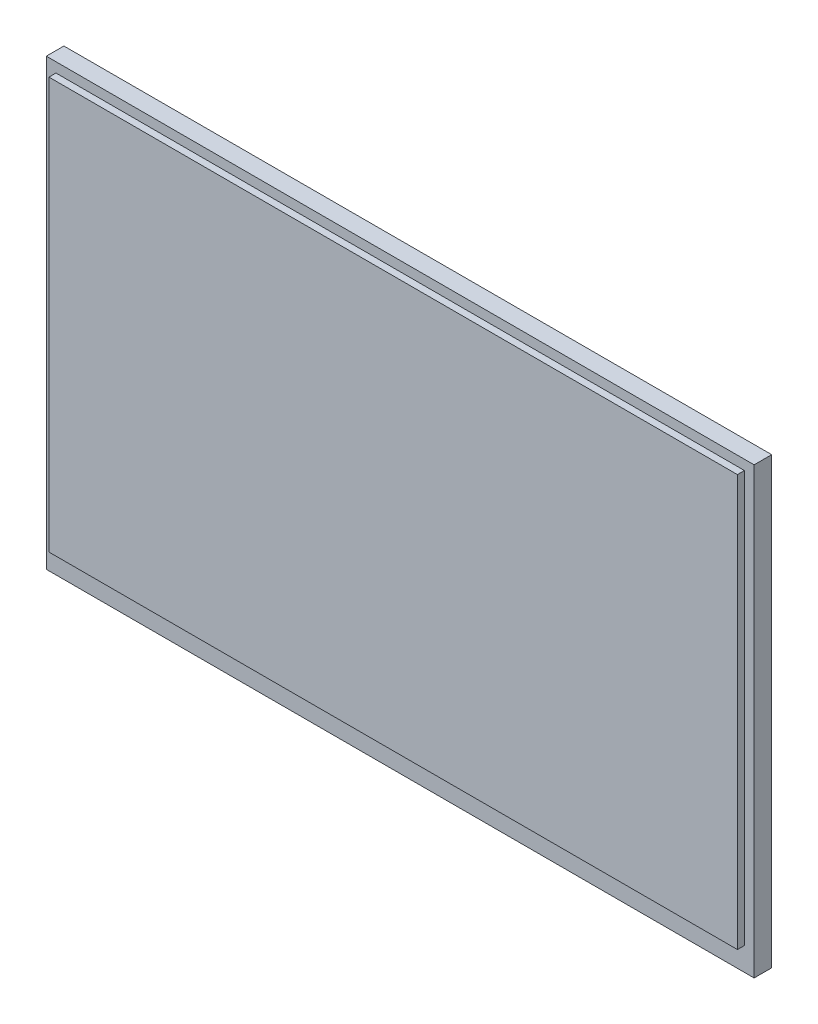
from build123d import *

# Parameters (mm, degrees)
SKETCH1_W           = 120.8
SKETCH1_H           = 75.85
BOSS_EXTRUDE1_DEPTH = 3
SKETCH2_W           = 117.5
SKETCH2_H           = 70.2
BOSS_EXTRUDE2_DEPTH = 1.2


with BuildPart() as part:
    # Sketch1 → Boss-Extrude1 (new body)
    with BuildSketch(Plane.XY):
        Rectangle(SKETCH1_W, SKETCH1_H)
    extrude(amount=BOSS_EXTRUDE1_DEPTH)

    # Sketch2 → Boss-Extrude2 (add)
    with BuildSketch(Plane.XY.offset(3)):
        with Locations((0, 1.155)):
            Rectangle(SKETCH2_W, SKETCH2_H)
    extrude(amount=BOSS_EXTRUDE2_DEPTH)


solid = part.part
